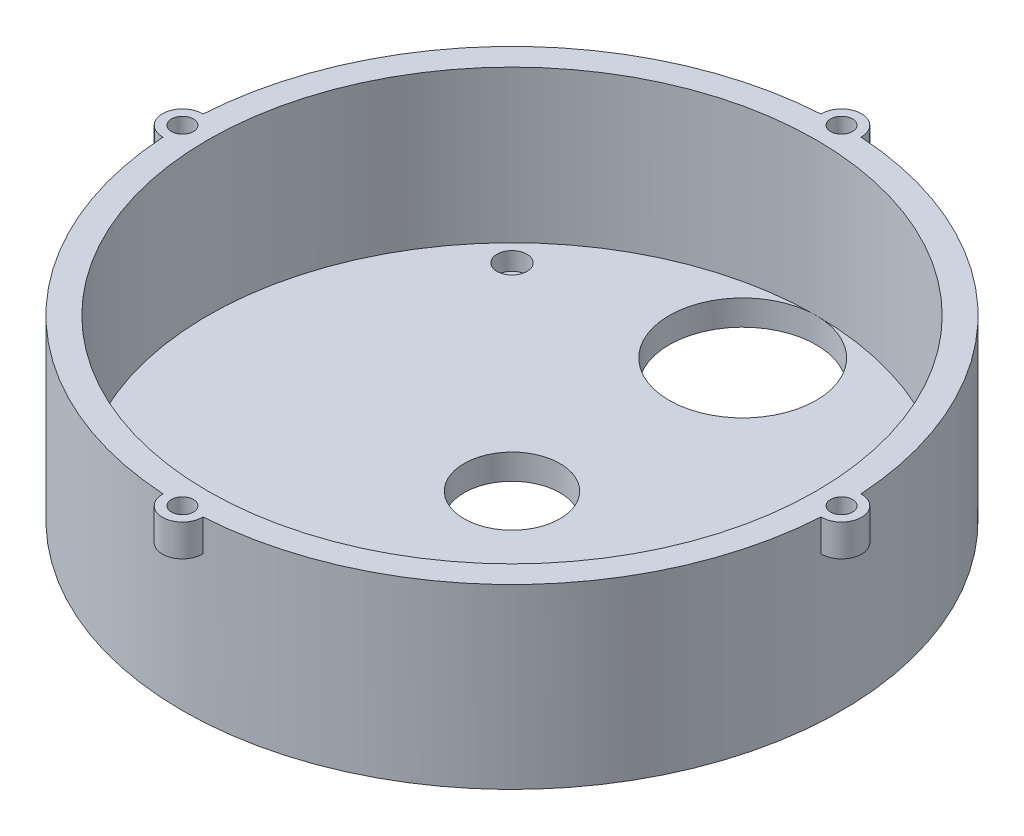
from build123d import *

# Parameters (mm, degrees)
SKETCH1_R           = 82.55
SKETCH1_R_2         = 12
SKETCH1_R_3         = 18.415
BOSS_EXTRUDE1_DEPTH = 6.35
BOSS_EXTRUDE2_START = 38.1
SKETCH1_3_R         = 82.55
BOSS_EXTRUDE2_DEPTH = 38.1
SKETCH5_R           = 3.75
SKETCH5_R_2         = 2.25
CUT_EXTRUDE1_DEPTH  = 4.5
SKETCH5_4_R         = 2.25
CUT_EXTRUDE2_DEPTH  = 12.7
SKETCH6_R           = 5
BOSS_EXTRUDE3_DEPTH = 8
SKETCH6_3_R         = 2.75
CUT_EXTRUDE3_DEPTH  = 7


with BuildPart() as part:
    # Sketch1 → Boss-Extrude1 (new body)
    with BuildSketch(Plane(origin=(0, 0, 0), x_dir=(1, 0, 0), z_dir=(0, 1, 0))):
        Circle(SKETCH1_R)
        Circle(SKETCH1_R_2, mode=Mode.SUBTRACT)
        with Locations((0, 57.785)):
            Circle(SKETCH1_R_3, mode=Mode.SUBTRACT)
    extrude(amount=-BOSS_EXTRUDE1_DEPTH)

    # Sketch1<3> → Boss-Extrude2 (add)
    with BuildSketch(Plane(origin=(0, 0, 0), x_dir=(1, 0, 0), z_dir=(0, 1, 0)).offset(BOSS_EXTRUDE2_START)):
        Circle(SKETCH1_3_R)
        with BuildLine():
            ThreePointArc((-4.2e-08, 76.2), (53.881536712, 53.881536741), (76.2, 0))
            ThreePointArc((76.2, 0), (-53.881536712, -53.881536741), (-4.2e-08, 76.2))
        make_face(mode=Mode.SUBTRACT)
    extrude(amount=-BOSS_EXTRUDE2_DEPTH)

    # Sketch5 → Cut-Extrude1 (cut)
    # profile 1 of 4: a face of its own
    with BuildSketch(Plane(origin=(0, 0, 0), x_dir=(1, 0, 0), z_dir=(0, 1, 0))):
        with Locations((-49.53, -49.53)):
            Circle(SKETCH5_R)
        with Locations((-49.53, -49.53)):
            Circle(SKETCH5_R_2, mode=Mode.SUBTRACT)
    # profile 2 of 4: a face of its own
    with BuildSketch(Plane(origin=(0, 0, 0), x_dir=(1, 0, 0), z_dir=(0, 1, 0))):
        with Locations((-49.53, 49.53)):
            Circle(SKETCH5_R)
        with Locations((-49.53, 49.53)):
            Circle(SKETCH5_R_2, mode=Mode.SUBTRACT)
    # profile 3 of 4: a face of its own
    with BuildSketch(Plane(origin=(0, 0, 0), x_dir=(1, 0, 0), z_dir=(0, 1, 0))):
        with Locations((49.53, 49.53)):
            Circle(SKETCH5_R)
        with Locations((49.53, 49.53)):
            Circle(SKETCH5_R_2, mode=Mode.SUBTRACT)
    # profile 4 of 4: a face of its own
    with BuildSketch(Plane(origin=(0, 0, 0), x_dir=(1, 0, 0), z_dir=(0, 1, 0))):
        with Locations((49.53, -49.53)):
            Circle(SKETCH5_R)
        with Locations((49.53, -49.53)):
            Circle(SKETCH5_R_2, mode=Mode.SUBTRACT)
    extrude(amount=-CUT_EXTRUDE1_DEPTH, mode=Mode.SUBTRACT)

    # Sketch5<4> → Cut-Extrude2 (cut)
    with BuildSketch(Plane(origin=(0, 0, 0), x_dir=(1, 0, 0), z_dir=(0, 1, 0))):
        with Locations((-49.53, 49.53)):
            Circle(SKETCH5_4_R)
        with Locations((49.53, 49.53)):
            Circle(SKETCH5_4_R)
        with Locations((49.53, -49.53)):
            Circle(SKETCH5_4_R)
        with Locations((-49.53, -49.53)):
            Circle(SKETCH5_4_R)
    extrude(amount=-CUT_EXTRUDE2_DEPTH, mode=Mode.SUBTRACT)

    # Sketch6 → Boss-Extrude3 (add)
    with BuildSketch(Plane(origin=(0, 38.1, 0), x_dir=(1, 0, 0), z_dir=(0, 1, 0))):
        with Locations((-82.55, 0)):
            Circle(SKETCH6_R)
        with Locations((0, 82.55)):
            Circle(SKETCH6_R)
        with Locations((0, -82.55)):
            Circle(SKETCH6_R)
        with Locations((82.55, 0)):
            Circle(SKETCH6_R)
    extrude(amount=-BOSS_EXTRUDE3_DEPTH)

    # Sketch6<3> → Cut-Extrude3 (cut)
    with BuildSketch(Plane(origin=(0, 38.1, 0), x_dir=(1, 0, 0), z_dir=(0, 1, 0))):
        with Locations((-82.55, 0)):
            Circle(SKETCH6_3_R)
        with Locations((0, 82.55)):
            Circle(SKETCH6_3_R)
        with Locations((0, -82.55)):
            Circle(SKETCH6_3_R)
        with Locations((82.55, 0)):
            Circle(SKETCH6_3_R)
    extrude(amount=-CUT_EXTRUDE3_DEPTH, mode=Mode.SUBTRACT)


solid = part.part
